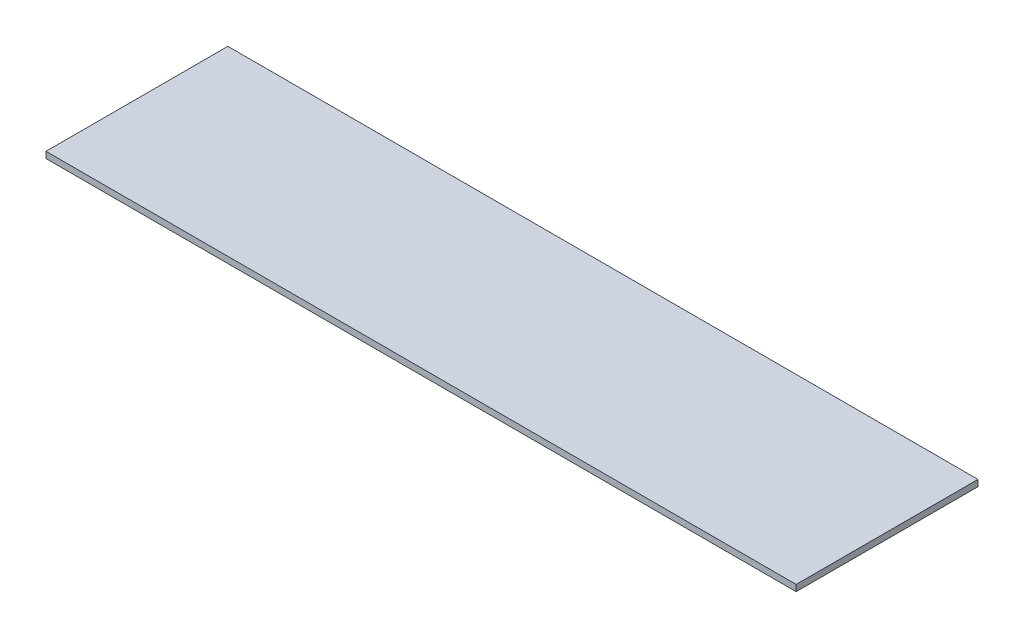
from build123d import *

# Parameters (mm, degrees)
SKETCH1_W           = 594
SKETCH1_H           = 144
BOSS_EXTRUDE1_DEPTH = 5


with BuildPart() as part:
    # Sketch1 → Boss-Extrude1 (new body)
    with BuildSketch(Plane(origin=(0, 0, 0), x_dir=(1, 0, 0), z_dir=(0, 1, 0))):
        with Locations((297, 72)):
            Rectangle(SKETCH1_W, SKETCH1_H)
    extrude(amount=BOSS_EXTRUDE1_DEPTH)


solid = part.part
